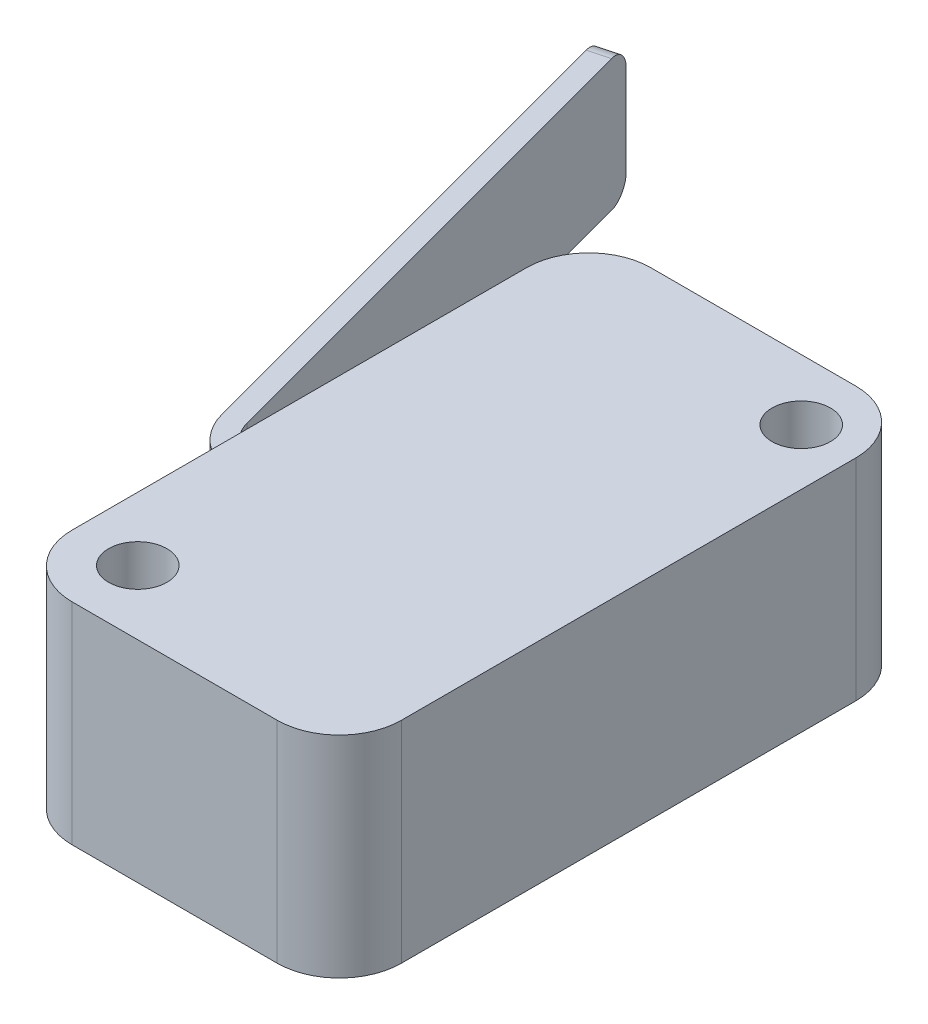
from build123d import *

# Parameters (mm, degrees)
SKETCH1_W           = 15.9004
SKETCH1_H           = 27.94
BOSS_EXTRUDE1_DEPTH = 5.08
FILLET1_R           = 3
BOSS_EXTRUDE2_DEPTH = 3.175
FILLET2_R           = 1
SKETCH3_R           = 1.4097
CUT_EXTRUDE1_DEPTH  = 16.35


with BuildPart() as part:
    # Sketch1 → Boss-Extrude1 (new, symmetric)
    with BuildSketch(Plane(origin=(0, 0, 0), x_dir=(1, 0, 0), z_dir=(0, 1, 0))):
        Rectangle(SKETCH1_W, SKETCH1_H)
    extrude(amount=BOSS_EXTRUDE1_DEPTH, both=True)

    # Fillet1
    fillet1_edges = [part.edges().sort_by_distance(p)[0] for p in [
        (7.9502, 0, 13.97),
        (-7.9502, 0, 13.97),
        (-7.9502, 0, -13.97),
        (7.9502, 0, -13.97),
    ]]
    fillet(fillet1_edges, radius=FILLET1_R)

    # Sketch2 → Boss-Extrude2 (add, symmetric)
    with BuildSketch(Plane(origin=(0, 0, 0), x_dir=(1, 0, 0), z_dir=(0, 1, 0))):
        with BuildLine():
            Line((-17.773175009, 24.379180955), (-11.074445198, -0.620819045))
            ThreePointArc((-11.074445198, -0.620819045), (-10.002952006, -2.224421931), (-8.176667719, -2.84436191))
            Line((-8.176667719, -2.84436191), (-3.749367894, -2.84436191))
            Line((-3.749367894, -2.84436191), (-3.749367894, -1.84436191))
            Line((-3.749367894, -1.84436191), (-8.176667719, -1.84436191))
            ThreePointArc((-8.176667719, -1.84436191), (-9.394190577, -1.43106859), (-10.108519372, -0.362))
            Line((-10.108519372, -0.362), (-16.807249182, 24.638))
            Line((-16.807249182, 24.638), (-17.773175009, 24.379180955))
        make_face()
    extrude(amount=BOSS_EXTRUDE2_DEPTH, both=True)

    # Fillet2
    fillet2_edges = [part.edges().sort_by_distance(p)[0] for p in [
        (-17.290212095, 3.175, -24.508590477),
        (-17.290212095, -3.175, -24.508590477),
    ]]
    fillet(fillet2_edges, radius=FILLET2_R)

    # Sketch3 → Cut-Extrude1 (cut)
    with BuildSketch(Plane(origin=(0, 5.08, 0), x_dir=(1, 0, 0), z_dir=(0, 1, 0))):
        with Locations(Location((5.248249785, 11.033336761, 0), (0, 0, 270))):
            Circle(SKETCH3_R)
        with Locations(Location((-4.884430829, -10.866108062, 0), (0, 0, 270))):
            Circle(SKETCH3_R)
    extrude(amount=-CUT_EXTRUDE1_DEPTH, mode=Mode.SUBTRACT)


solid = part.part
